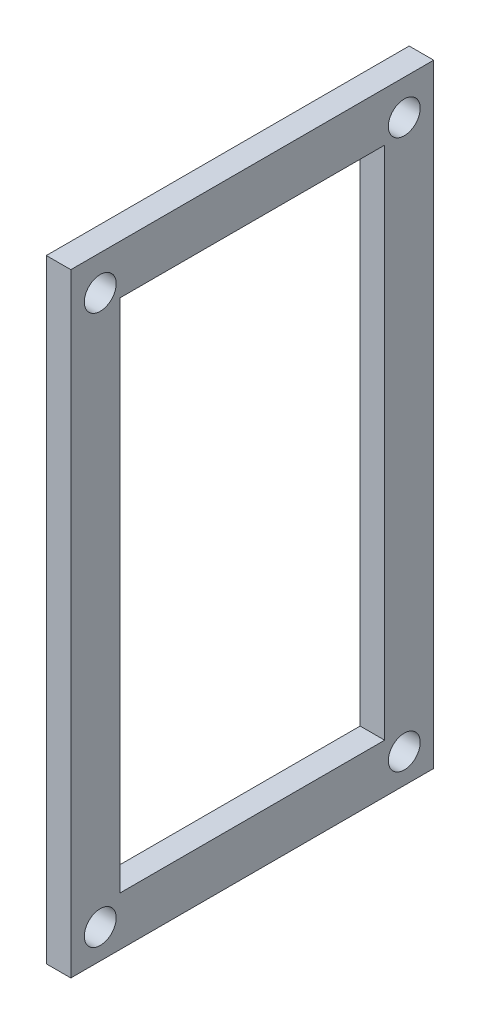
from build123d import *

# Parameters (mm, degrees)
SKETCH1_W           = 70
SKETCH1_H           = 121.1
SKETCH1_R           = 3.25
SKETCH1_W_2         = 54
SKETCH1_H_2         = 105.1
BOSS_EXTRUDE1_DEPTH = 5
SKETCH2_W           = 5
SKETCH2_H           = 121.1
BOSS_EXTRUDE2_DEPTH = 2
SKETCH3_W           = 5
SKETCH3_H           = 72
BOSS_EXTRUDE3_DEPTH = 2
SKETCH4_W           = 5
SKETCH4_H           = 123.1
BOSS_EXTRUDE4_DEPTH = 2
SKETCH5_W           = 5
SKETCH5_H           = 74
BOSS_EXTRUDE5_DEPTH = 2


with BuildPart() as part:
    # Sketch1 → Boss-Extrude1 (new body)
    with BuildSketch(Plane(origin=(0, 0, 0), x_dir=(0, 0, -1), z_dir=(1, 0, 0))):
        Rectangle(SKETCH1_W, SKETCH1_H)
        with Locations((-31, -56.55)):
            Circle(SKETCH1_R, mode=Mode.SUBTRACT)
        with Locations(Location((31, -56.55, 0), (0, 0, 180))):
            Circle(SKETCH1_R, mode=Mode.SUBTRACT)
        with Locations((-31, 55.45)):
            Circle(SKETCH1_R, mode=Mode.SUBTRACT)
        with Locations(Location((31, 55.45, 0), (0, 0, 180))):
            Circle(SKETCH1_R, mode=Mode.SUBTRACT)
        Rectangle(SKETCH1_W_2, SKETCH1_H_2, mode=Mode.SUBTRACT)
    extrude(amount=BOSS_EXTRUDE1_DEPTH)

    # Sketch2 → Boss-Extrude2 (add)
    with BuildSketch(Plane.XY.offset(35)):
        with Locations((2.5, 0)):
            Rectangle(SKETCH2_W, SKETCH2_H)
    extrude(amount=BOSS_EXTRUDE2_DEPTH)

    # Sketch3 → Boss-Extrude3 (add)
    with BuildSketch(Plane(origin=(0, 60.55, 0), x_dir=(1, 0, 0), z_dir=(0, 1, 0))):
        with Locations((2.5, -1)):
            Rectangle(SKETCH3_W, SKETCH3_H)
    extrude(amount=BOSS_EXTRUDE3_DEPTH)

    # Sketch4 → Boss-Extrude4 (add)
    with BuildSketch(Plane(origin=(0, 0, -35), x_dir=(-1, 0, 0), z_dir=(0, 0, -1))):
        with Locations((-2.5, 1)):
            Rectangle(SKETCH4_W, SKETCH4_H)
    extrude(amount=BOSS_EXTRUDE4_DEPTH)

    # Sketch5 → Boss-Extrude5 (add)
    with BuildSketch(Plane.XZ.offset(60.55)):
        with Locations((2.5, 0)):
            Rectangle(SKETCH5_W, SKETCH5_H)
    extrude(amount=BOSS_EXTRUDE5_DEPTH)


solid = part.part
